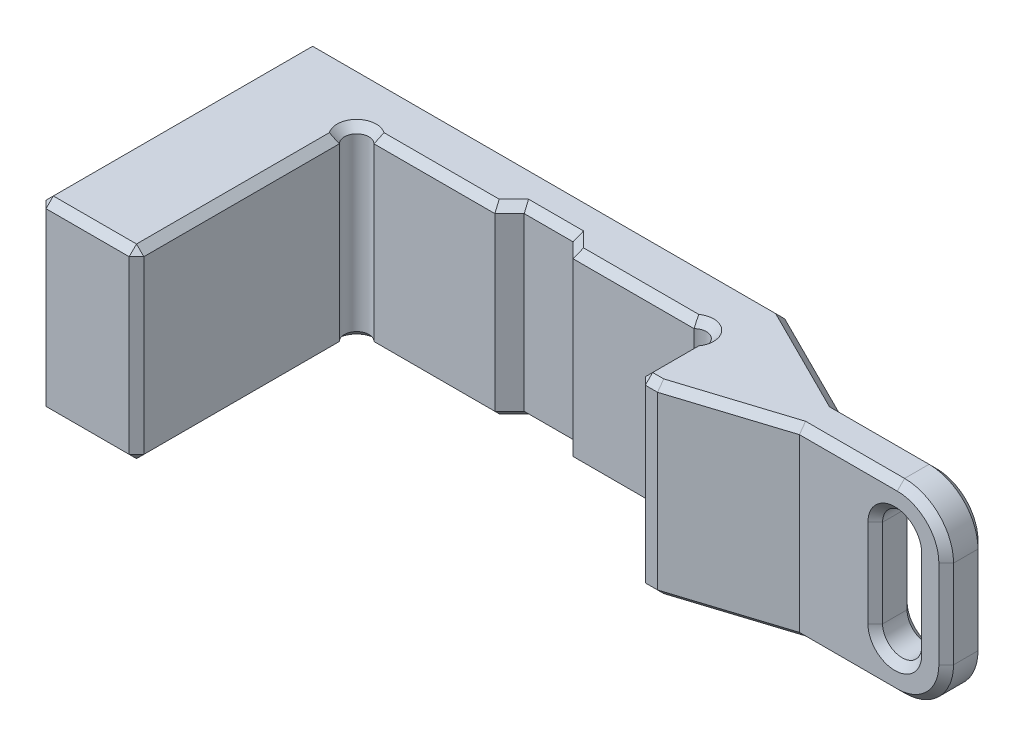
from build123d import *

# Parameters (mm, degrees)
CREATE_PROFILE_DEPTH     = 38
CUT_SHACKLE_HOLE_DEPTH   = 160.753716702
ROUND_EDGES_R            = 10
UNECESSARY_CHAMFERS_SIZE = 1.5


with BuildPart() as part:
    # Sketch1 → Create profile (new body)
    with BuildSketch(Plane(origin=(0, 0, 0), x_dir=(1, 0, 0), z_dir=(0, 1, 0))):
        with BuildLine():
            Line((0, 0), (0, 56))
            Line((0, 56), (96.5, 56))
            Line((96.5, 56), (118.5, 45))
            Line((118.5, 45), (148.5, 45))
            Line((148.5, 45), (148.5, 37))
            Line((148.5, 37), (118.5, 37))
            Line((118.5, 37), (96.5, 30))
            Line((96.5, 30), (92.5, 30))
            Line((92.5, 30), (92.5, 41.464466094))
            ThreePointArc((92.5, 41.464466094), (92.5, 45), (88.964466094, 45))
            Line((88.964466094, 45), (64.25, 45))
            Line((64.25, 45), (61.25, 48))
            Line((61.25, 48), (51.25, 48))
            Line((51.25, 48), (48.25, 45))
            Line((48.25, 45), (23.535533906, 45))
            ThreePointArc((23.535533906, 45), (20, 45), (20, 41.464466094))
            Line((20, 41.464466094), (20, 0))
            Line((20, 0), (0, 0))
        make_face()
    extrude(amount=CREATE_PROFILE_DEPTH)

    # Sketch3 → Cut shackle hole (cut, through all)
    with BuildSketch(Plane(origin=(0, 0, -45), x_dir=(-1, 0, 0), z_dir=(0, 0, -1))):
        with BuildLine():
            Line((-134, 28), (-134, 10))
            ThreePointArc((-134, 10), (-138, 6), (-142, 10))
            Line((-142, 10), (-142, 28))
            ThreePointArc((-142, 28), (-138, 32), (-134, 28))
        make_face()
    extrude(amount=-CUT_SHACKLE_HOLE_DEPTH, mode=Mode.SUBTRACT)

    # Round Edges
    round_edges_edges = [part.edges().sort_by_distance(p)[0] for p in [
        (148.5, 0, -41),
        (148.5, 38, -41),
    ]]
    fillet(round_edges_edges, radius=ROUND_EDGES_R)

    # Unecessary chamfers
    unecessary_chamfers_edges = [part.edges().sort_by_distance(p)[0] for p in [
        (20, 38, -45),
        (35.892766953, 38, -45),
        (0, 0, -28),
        (48.25, 0, -56),
        (107.5, 0, -50.5),
        (128.5, 0, -37),
        (107.5, 0, -33.5),
        (94.5, 0, -30),
        (92.5, 0, -35.732233047),
        (49.75, 38, -46.5),
        (92.5, 0, -45),
        (76.607233047, 0, -45),
        (62.75, 0, -46.5),
        (56.25, 0, -48),
        (49.75, 0, -46.5),
        (35.892766953, 0, -45),
        (20, 0, -45),
        (20, 0, -20.732233047),
        (10, 0, 0),
        (56.25, 38, -48),
        (62.75, 38, -46.5),
        (0, 19, 0),
        (0, 19, -56),
        (92.5, 19, -30),
        (20, 19, 0),
        (76.607233047, 38, -45),
        (92.5, 38, -45),
        (92.5, 38, -35.732233047),
        (94.5, 38, -30),
        (107.5, 38, -33.5),
        (10, 38, 0),
        (128.5, 38, -37),
        (138, 32, -37),
        (134, 19, -37),
        (138, 6, -37),
        (142, 19, -37),
        (138, 32, -45),
        (142, 19, -45),
        (138, 6, -45),
        (134, 19, -45),
        (107.5, 38, -50.5),
        (48.25, 38, -56),
        (0, 38, -28),
        (148.5, 19, -45),
        (148.5, 19, -37),
        (128.5, 0, -45),
        (128.5, 38, -45),
        (145.571067812, 35.071067812, -45),
        (145.571067812, 2.928932188, -45),
        (145.571067812, 35.071067812, -37),
        (145.571067812, 2.928932188, -37),
        (20, 38, -20.732233047),
    ]]
    chamfer(unecessary_chamfers_edges, length=UNECESSARY_CHAMFERS_SIZE)


solid = part.part
